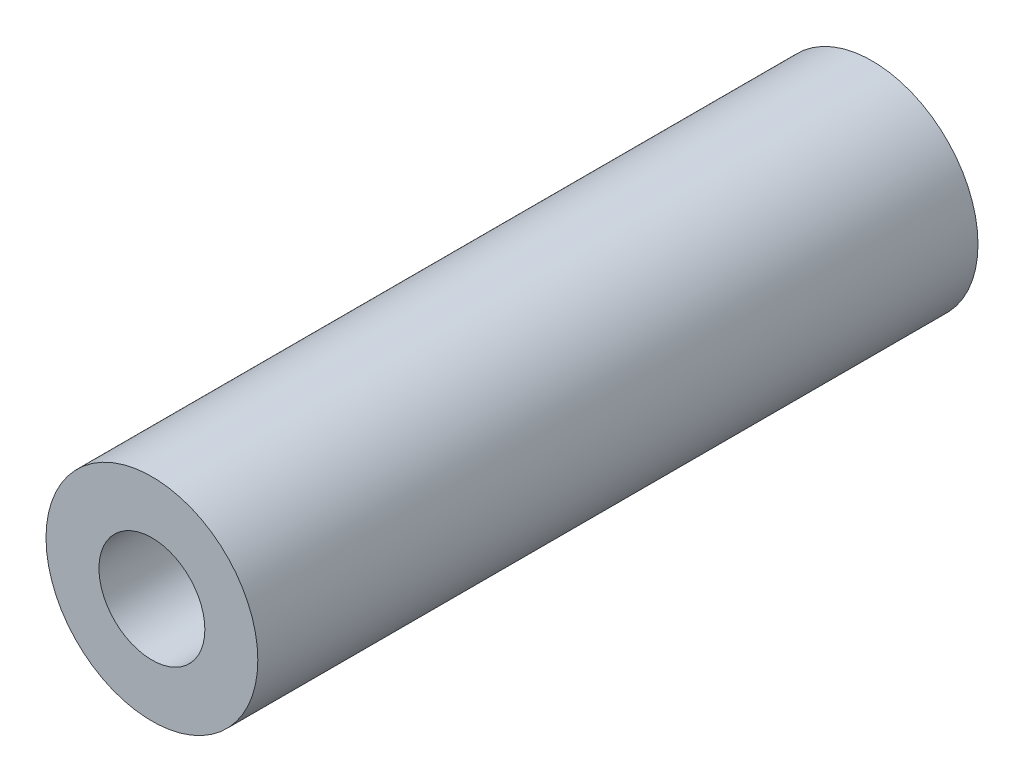
from build123d import *

# Parameters (mm, degrees)
SKETCH1_R           = 12.7
SKETCH1_R_2         = 6.35
BOSS_EXTRUDE1_DEPTH = 86.36


with BuildPart() as part:
    # Sketch1 → Boss-Extrude1 (new body)
    with BuildSketch(Plane.XY):
        Circle(SKETCH1_R)
        Circle(SKETCH1_R_2, mode=Mode.SUBTRACT)
    extrude(amount=-BOSS_EXTRUDE1_DEPTH)


solid = part.part
